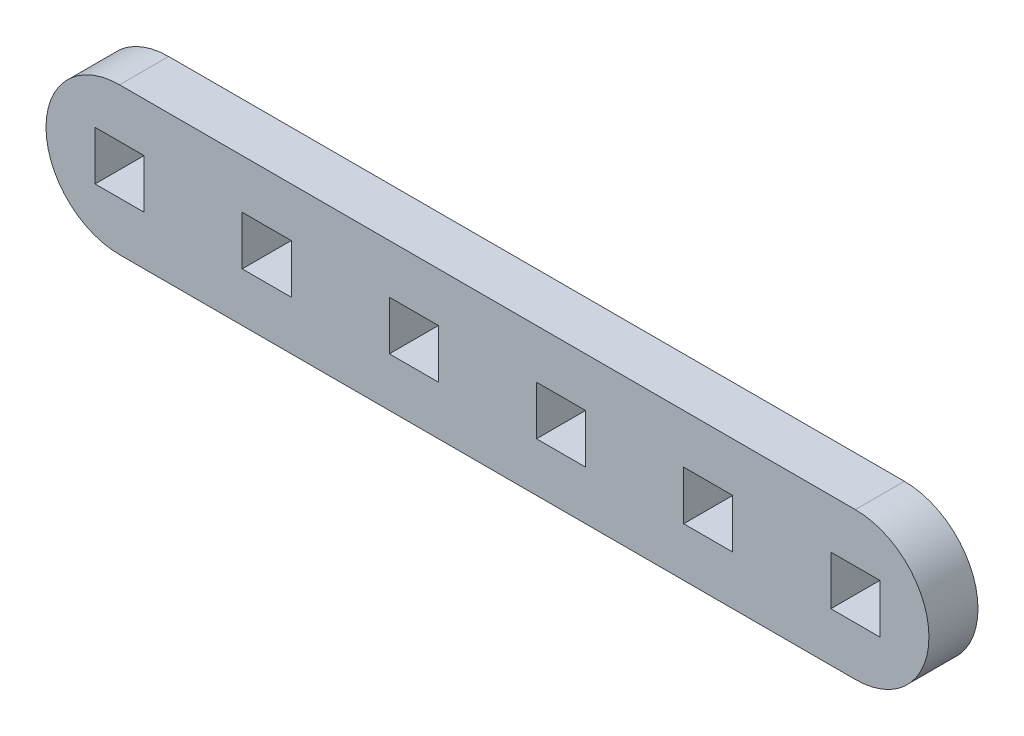
from build123d import *

# Parameters (mm, degrees)
MODEL_W                 = 3
MODEL_H                 = 3
SALIENTE_EXTRUIR1_DEPTH = 3


with BuildPart() as part:
    # Model → Saliente-Extruir1 (new body)
    with BuildSketch(Plane.XY):
        with BuildLine():
            Line((12.181222481, 298.136475095), (57.181222481, 298.136475095))
            ThreePointArc((57.181222481, 298.136475095), (61.681222481, 293.636475095), (57.181222481, 289.136475095))
            Line((57.181222481, 289.136475095), (12.181222481, 289.136475095))
            ThreePointArc((12.181222481, 289.136475095), (7.681222481, 293.636475095), (12.181222481, 298.136475095))
        make_face()
        with Locations((12.181222481, 293.636475095)):
            Rectangle(MODEL_W, MODEL_H, mode=Mode.SUBTRACT)
        with Locations((21.181222481, 293.636475095)):
            Rectangle(MODEL_W, MODEL_H, mode=Mode.SUBTRACT)
        with Locations((30.181222481, 293.636475095)):
            Rectangle(MODEL_W, MODEL_H, mode=Mode.SUBTRACT)
        with Locations((39.181222481, 293.636475095)):
            Rectangle(MODEL_W, MODEL_H, mode=Mode.SUBTRACT)
        with Locations((57.181222481, 293.636475095)):
            Rectangle(MODEL_W, MODEL_H, mode=Mode.SUBTRACT)
        with Locations((48.181222481, 293.636475095)):
            Rectangle(MODEL_W, MODEL_H, mode=Mode.SUBTRACT)
    extrude(amount=SALIENTE_EXTRUIR1_DEPTH)


solid = part.part
